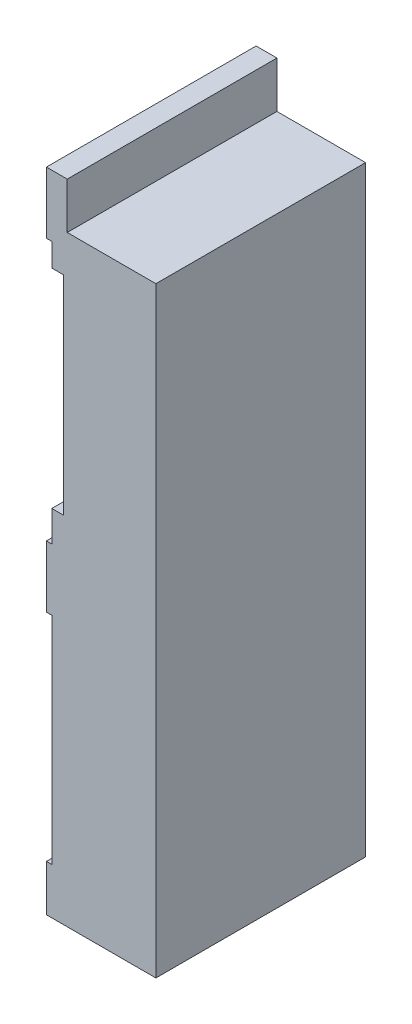
from build123d import *

# Parameters (mm, degrees)
GUIDE_AND_SOLID_STOPS_DEPTH   = 13.6
SKETCH_3_W                    = 8.4
SKETCH_3_H                    = 14
NUT_TONGUE_CHANNEL_DEPTH      = 2.8
SKETCH_4_W                    = 6.25
SKETCH_4_H                    = 5.2
LOWER_YOKE_RELIEF_DEPTH       = 3
SKETCH_5_W                    = 3.7
SKETCH_5_H                    = 3
LOWER_INWARD_STOP_DEPTH       = 3.8
SKETCH_7_W                    = 3.7
SKETCH_7_H                    = 3
EXTRUDE_2_DEPTH               = 3.8
REMOVE_LOWER_TAIL_DEPTH       = 62.002151601
REMOVE_LOWER_TAIL_DEPTH_BACK  = 62.002151601
SKETCH_8_W                    = 17
SKETCH_8_H                    = 17
WIDER_SHAFT_RELIEF_DEPTH      = 62.002151601
WIDER_SHAFT_RELIEF_DEPTH_BACK = 62.002151601
SKETCH_9_W                    = 9.85
SKETCH_9_H                    = 46


with BuildPart() as part:
    # 草图1 → Guide_and_solid_stops (new body)
    with BuildSketch(Plane.XY):
        Polygon((10.2, 0), (16.95, 0), (16.95, 54), (11.2, 54), (11.2, 57), (4.7, 57), (4.7, 53), (10.2, 53), (10.2, 51.5), (10.95, 51.5), (10.95, 38), (10.2, 38), (10.2, 36), (4.7, 36), (4.7, 32), (10.2, 32), align=None)
    extrude(amount=GUIDE_AND_SOLID_STOPS_DEPTH)

    # 草图3 → Nut_tongue_channel (cut, symmetric)
    with BuildSketch(Plane.XY.offset(6.8)):
        with Locations((11.2, 44.5)):
            Rectangle(SKETCH_3_W, SKETCH_3_H)
    extrude(amount=NUT_TONGUE_CHANNEL_DEPTH, both=True, mode=Mode.SUBTRACT)

    # 草图4 → Lower_yoke_relief (cut, symmetric)
    with BuildSketch(Plane.XY.offset(6.8)):
        with Locations((7.125, 33.6)):
            Rectangle(SKETCH_4_W, SKETCH_4_H)
    extrude(amount=LOWER_YOKE_RELIEF_DEPTH, both=True, mode=Mode.SUBTRACT)

    # 草图5 → Lower_inward_stop (add)
    with BuildSketch(Plane.XY):
        with Locations((9.35, 16.5)):
            Rectangle(SKETCH_5_W, SKETCH_5_H)
    extrude(amount=LOWER_INWARD_STOP_DEPTH)

    # 草图7 → 凸台-拉伸2 (add)
    with BuildSketch(Plane.XY.offset(9.8)):
        with Locations((9.35, 16.5)):
            Rectangle(SKETCH_7_W, SKETCH_7_H)
    extrude(amount=EXTRUDE_2_DEPTH)

    # 草图8 → Remove_lower_tail (cut, two sides: drawn at the far end of the back side and taken through both)
    with BuildSketch(Plane.XY.offset(-REMOVE_LOWER_TAIL_DEPTH_BACK)):
        with Locations((11.5, 6.5)):
            Rectangle(SKETCH_8_W, SKETCH_8_H)
    extrude(amount=REMOVE_LOWER_TAIL_DEPTH + REMOVE_LOWER_TAIL_DEPTH_BACK, mode=Mode.SUBTRACT)

    # 草图9 → Wider_shaft_relief (cut, two sides: drawn at the far end of the back side and taken through both)
    with BuildSketch(Plane.XY.offset(-WIDER_SHAFT_RELIEF_DEPTH_BACK)):
        with Locations((4.925, 36)):
            Rectangle(SKETCH_9_W, SKETCH_9_H)
    extrude(amount=WIDER_SHAFT_RELIEF_DEPTH + WIDER_SHAFT_RELIEF_DEPTH_BACK, mode=Mode.SUBTRACT)


solid = part.part
